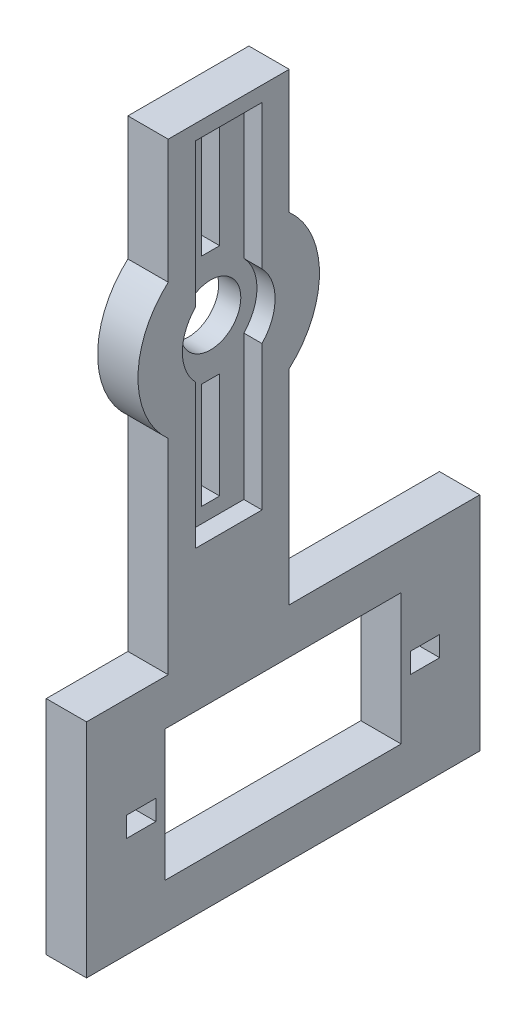
from build123d import *

# Parameters (mm, degrees)
BOSS_EXTRUDE1_START  = -59.6
SKETCH1_R            = 9
BOSS_EXTRUDE1_DEPTH  = 4
BOSS_EXTRUDE2_START  = -58
SKETCH2_W            = 4
SKETCH2_H            = 49
BOSS_EXTRUDE2_DEPTH  = 12
BOSS_EXTRUDE3_START  = -76.9
SKETCH3_W            = 4
SKETCH3_H            = 22
BOSS_EXTRUDE3_DEPTH  = 39
BOSS_EXTRUDE4_START  = -57.4
SKETCH4_R            = 4.6
BOSS_EXTRUDE4_DEPTH  = 2.3
BOSS_EXTRUDE5_START  = -55.3
SKETCH5_W            = 2.3
SKETCH5_H            = 17.5
BOSS_EXTRUDE5_DEPTH  = 6.6
BOSS_EXTRUDE6_START  = -52.9
SKETCH6_W            = 6
SKETCH6_H            = 10.5
BOSS_EXTRUDE6_DEPTH  = 1.8
BOSS_EXTRUDE7_START  = -55.3
SKETCH7_W            = 2.3
SKETCH7_H            = 17.5
BOSS_EXTRUDE7_DEPTH  = 6.6
BOSS_EXTRUDE8_START  = -52.9
SKETCH8_W            = 6
SKETCH8_H            = 10.5
BOSS_EXTRUDE8_DEPTH  = 1.8
BOSS_EXTRUDE9_START  = -60.6
SKETCH9_R            = 3
BOSS_EXTRUDE9_DEPTH  = 6
BOSS_EXTRUDE10_START = -69.1
SKETCH10_W           = 6
SKETCH10_H           = 13
BOSS_EXTRUDE10_DEPTH = 23.4
BOSS_EXTRUDE11_START = -72.925
SKETCH11_W           = 6
SKETCH11_H           = 2
BOSS_EXTRUDE11_DEPTH = 2.9
BOSS_EXTRUDE12_START = -44.775
SKETCH12_W           = 6
SKETCH12_H           = 2
BOSS_EXTRUDE12_DEPTH = 2.9


with BuildPart() as part:
    # Sketch1 → Boss-Extrude1 (new body)
    with BuildSketch(Plane(origin=(0, 0, 0), x_dir=(0, 0, -1), z_dir=(1, 0, 0)).offset(BOSS_EXTRUDE1_START)):
        with Locations((52, 18)):
            Circle(SKETCH1_R)
    extrude(amount=BOSS_EXTRUDE1_DEPTH)

    # Sketch2 → Boss-Extrude2 (add)
    with BuildSketch(Plane.XY.offset(BOSS_EXTRUDE2_START)):
        with Locations((-57.6, 12.5)):
            Rectangle(SKETCH2_W, SKETCH2_H)
    extrude(amount=BOSS_EXTRUDE2_DEPTH)

    # Sketch3 → Boss-Extrude3 (add)
    with BuildSketch(Plane.XY.offset(BOSS_EXTRUDE3_START)):
        with Locations((-57.6, -20)):
            Rectangle(SKETCH3_W, SKETCH3_H)
    extrude(amount=BOSS_EXTRUDE3_DEPTH)


with BuildPart() as body_2:
    # Sketch4 → Boss-Extrude4 (new body)
    with BuildSketch(Plane(origin=(0, 0, 0), x_dir=(0, 0, -1), z_dir=(1, 0, 0)).offset(BOSS_EXTRUDE4_START)):
        with Locations((52, 18)):
            Circle(SKETCH4_R)
    extrude(amount=BOSS_EXTRUDE4_DEPTH)


with BuildPart() as part_1:
    add(part.part)

    # Combine1: cut body 2
    add(body_2.part, mode=Mode.SUBTRACT)


with BuildPart() as body_2_2:
    # Sketch5 → Boss-Extrude5 (new body)
    with BuildSketch(Plane.XY.offset(BOSS_EXTRUDE5_START)):
        with Locations((-56.25, 26.75)):
            Rectangle(SKETCH5_W, SKETCH5_H)
    extrude(amount=BOSS_EXTRUDE5_DEPTH)


with BuildPart() as part_2:
    add(part_1.part)

    # Combine2: cut body 2 2
    add(body_2_2.part, mode=Mode.SUBTRACT)


with BuildPart() as body_2_3:
    # Sketch6 → Boss-Extrude6 (new body)
    with BuildSketch(Plane.XY.offset(BOSS_EXTRUDE6_START)):
        with Locations((-57.6, 28.75)):
            Rectangle(SKETCH6_W, SKETCH6_H)
    extrude(amount=BOSS_EXTRUDE6_DEPTH)


with BuildPart() as part_3:
    add(part_2.part)

    # Combine3: cut body 2 3
    add(body_2_3.part, mode=Mode.SUBTRACT)


with BuildPart() as body_2_4:
    # Sketch7 → Boss-Extrude7 (new body)
    with BuildSketch(Plane.XY.offset(BOSS_EXTRUDE7_START)):
        with Locations((-56.25, 9.25)):
            Rectangle(SKETCH7_W, SKETCH7_H)
    extrude(amount=BOSS_EXTRUDE7_DEPTH)


with BuildPart() as part_4:
    add(part_3.part)

    # Combine4: cut body 2 4
    add(body_2_4.part, mode=Mode.SUBTRACT)


with BuildPart() as body_2_5:
    # Sketch8 → Boss-Extrude8 (new body)
    with BuildSketch(Plane.XY.offset(BOSS_EXTRUDE8_START)):
        with Locations((-57.6, 7.25)):
            Rectangle(SKETCH8_W, SKETCH8_H)
    extrude(amount=BOSS_EXTRUDE8_DEPTH)


with BuildPart() as part_5:
    add(part_4.part)

    # Combine5: cut body 2 5
    add(body_2_5.part, mode=Mode.SUBTRACT)


with BuildPart() as body_2_6:
    # Sketch9 → Boss-Extrude9 (new body)
    with BuildSketch(Plane(origin=(0, 0, 0), x_dir=(0, 0, -1), z_dir=(1, 0, 0)).offset(BOSS_EXTRUDE9_START)):
        with Locations((52, 18)):
            Circle(SKETCH9_R)
    extrude(amount=BOSS_EXTRUDE9_DEPTH)


with BuildPart() as part_6:
    add(part_5.part)

    # Combine6: cut body 2 6
    add(body_2_6.part, mode=Mode.SUBTRACT)


with BuildPart() as body_2_7:
    # Sketch10 → Boss-Extrude10 (new body)
    with BuildSketch(Plane.XY.offset(BOSS_EXTRUDE10_START)):
        with Locations((-57.6, -20)):
            Rectangle(SKETCH10_W, SKETCH10_H)
    extrude(amount=BOSS_EXTRUDE10_DEPTH)


with BuildPart() as part_7:
    add(part_6.part)

    # Combine7: cut body 2 7
    add(body_2_7.part, mode=Mode.SUBTRACT)


with BuildPart() as body_2_8:
    # Sketch11 → Boss-Extrude11 (new body)
    with BuildSketch(Plane.XY.offset(BOSS_EXTRUDE11_START)):
        with Locations((-57.6, -20)):
            Rectangle(SKETCH11_W, SKETCH11_H)
    extrude(amount=BOSS_EXTRUDE11_DEPTH)


with BuildPart() as part_8:
    add(part_7.part)

    # Combine8: cut body 2 8
    add(body_2_8.part, mode=Mode.SUBTRACT)


with BuildPart() as body_2_9:
    # Sketch12 → Boss-Extrude12 (new body)
    with BuildSketch(Plane.XY.offset(BOSS_EXTRUDE12_START)):
        with Locations((-57.6, -20)):
            Rectangle(SKETCH12_W, SKETCH12_H)
    extrude(amount=BOSS_EXTRUDE12_DEPTH)


with BuildPart() as part_9:
    add(part_8.part)

    # Combine9: cut body 2 9
    add(body_2_9.part, mode=Mode.SUBTRACT)


solid = part_9.part
